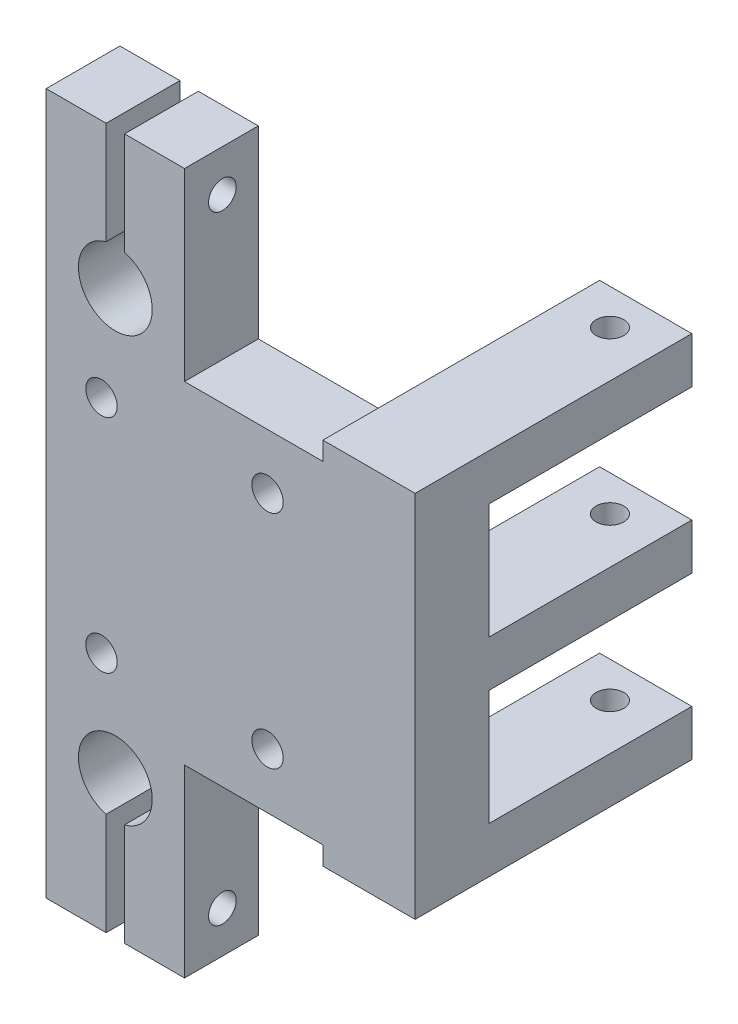
from build123d import *

# Parameters (mm, degrees)
SKETCH_1_W          = 30
SKETCH_1_H          = 36
SKETCH_1_R          = 1.7
EXTRUDE_1_DEPTH     = 8
SKETCH_2_R          = 3.75
CUT_EXTRUDE_1_DEPTH = 4.5
SKETCH_3_W          = 15
SKETCH_3_H          = 20
SKETCH_3_R          = 4
EXTRUDE_4_DEPTH     = 8
SKETCH_8_W          = 10
SKETCH_8_H          = 40
EXTRUDE_5_DEPTH     = 30
SKETCH_10_W         = 12
SKETCH_10_H         = 12.5
SKETCH_10_W_2       = 5
CUT_EXTRUDE_4_DEPTH = 30
SKETCH_11_R         = 1.5
CUT_EXTRUDE_5_DEPTH = 47
SKETCH_12_W         = 2
SKETCH_12_H         = 25.842259392
SKETCH_12_H_2       = 30.756424204
CUT_EXTRUDE_6_DEPTH = 10
SKETCH_13_R         = 1.5
CUT_EXTRUDE_7_DEPTH = 40
SKETCH_14_W         = 5
SKETCH_14_H         = 12.5
CUT_EXTRUDE_8_DEPTH = 10


with BuildPart() as part:
    # 草图1 → 凸台-拉伸1 (new body)
    with BuildSketch(Plane.XY):
        with Locations((-3.375, -1.625)):
            Rectangle(SKETCH_1_W, SKETCH_1_H)
        with Locations((-12.375, 10.375)):
            Circle(SKETCH_1_R, mode=Mode.SUBTRACT)
        with Locations((-12.375, -13.625)):
            Circle(SKETCH_1_R, mode=Mode.SUBTRACT)
        with Locations(Location((5.625, -13.625, 0), (0, 0, 180))):
            Circle(SKETCH_1_R, mode=Mode.SUBTRACT)
        with Locations(Location((5.625, 10.375, 0), (0, 0, 180))):
            Circle(SKETCH_1_R, mode=Mode.SUBTRACT)
    extrude(amount=EXTRUDE_1_DEPTH)

    # 草图2 → 切除-拉伸1 (cut)
    with BuildSketch(Plane(origin=(0, 0, 0), x_dir=(-1, 0, 0), z_dir=(0, 0, -1))):
        with Locations((12.375, 10.375)):
            Circle(SKETCH_2_R)
        with Locations(Location((-5.625, 10.375, 0), (0, 0, 180))):
            Circle(SKETCH_2_R)
        with Locations(Location((12.375, -13.625, 0), (0, 0, 180))):
            Circle(SKETCH_2_R)
        with Locations((-5.625, -13.625)):
            Circle(SKETCH_2_R)
    extrude(amount=-CUT_EXTRUDE_1_DEPTH, mode=Mode.SUBTRACT)

    # 草图3 → 凸台-拉伸4 (add)
    # profile 1 of 2: a face of its own
    with BuildSketch(Plane.XY.offset(8)):
        with Locations((-10.875, 26.375)):
            Rectangle(SKETCH_3_W, SKETCH_3_H)
        with Locations((-10.875, 21.375)):
            Circle(SKETCH_3_R, mode=Mode.SUBTRACT)
    # profile 2 of 2: a face of its own
    with BuildSketch(Plane.XY.offset(8)):
        with Locations((-10.875, -29.625)):
            Rectangle(SKETCH_3_W, SKETCH_3_H)
        with Locations((-10.875, -24.625)):
            Circle(SKETCH_3_R, mode=Mode.SUBTRACT)
    extrude(amount=-EXTRUDE_4_DEPTH)

    # 草图8 → 凸台-拉伸5 (add)
    with BuildSketch(Plane.XY.offset(8)):
        with Locations((16.625, -1.625)):
            Rectangle(SKETCH_8_W, SKETCH_8_H)
    extrude(amount=-EXTRUDE_5_DEPTH)

    # 草图10 → 切除-拉伸4 (cut)
    with BuildSketch(Plane.ZY.offset(-11.625)):
        with Locations((-16, 7.125)):
            Rectangle(SKETCH_10_W, SKETCH_10_H)
        with Locations((-2.5, 7.125)):
            Rectangle(SKETCH_10_W_2, SKETCH_10_H)
        with Locations((-2.5, -10.375)):
            Rectangle(SKETCH_10_W_2, SKETCH_10_H)
        with Locations((-16, -10.375)):
            Rectangle(SKETCH_10_W, SKETCH_10_H)
    extrude(amount=-CUT_EXTRUDE_4_DEPTH, mode=Mode.SUBTRACT)

    # 草图11 → 切除-拉伸5 (cut)
    with BuildSketch(Plane(origin=(0, 18.375, 0), x_dir=(1, 0, 0), z_dir=(0, 1, 0))):
        with Locations(Location((16.621809271, 18.123313308, 0), (0, 0, 180))):
            Circle(SKETCH_11_R)
    extrude(amount=-CUT_EXTRUDE_5_DEPTH, mode=Mode.SUBTRACT)

    # 草图12 → 切除-拉伸6 (cut)
    with BuildSketch(Plane(origin=(0, 0, 0), x_dir=(-1, 0, 0), z_dir=(0, 0, -1))):
        with Locations((10.875, 36.375)):
            Rectangle(SKETCH_12_W, SKETCH_12_H)
        with Locations((10.875, -39.625)):
            Rectangle(SKETCH_12_W, SKETCH_12_H_2)
    extrude(amount=-CUT_EXTRUDE_6_DEPTH, mode=Mode.SUBTRACT)

    # 草图13 → 切除-拉伸7 (cut)
    with BuildSketch(Plane.ZY.offset(18.375)):
        with Locations((3.892451488, 31.868119268)):
            Circle(SKETCH_13_R)
        with Locations(Location((3.892451488, -35.118119268, 0), (0, 0, 270))):
            Circle(SKETCH_13_R)
    extrude(amount=-CUT_EXTRUDE_7_DEPTH, mode=Mode.SUBTRACT)

    # 草图14 → 切除-拉伸8 (cut)
    with BuildSketch(Plane(origin=(21.625, 0, 0), x_dir=(0, 0, -1), z_dir=(1, 0, 0))):
        with Locations((7.5, 7.125)):
            Rectangle(SKETCH_14_W, SKETCH_14_H)
        with Locations((7.5, -10.375)):
            Rectangle(SKETCH_14_W, SKETCH_14_H)
    extrude(amount=-CUT_EXTRUDE_8_DEPTH, mode=Mode.SUBTRACT)


solid = part.part
